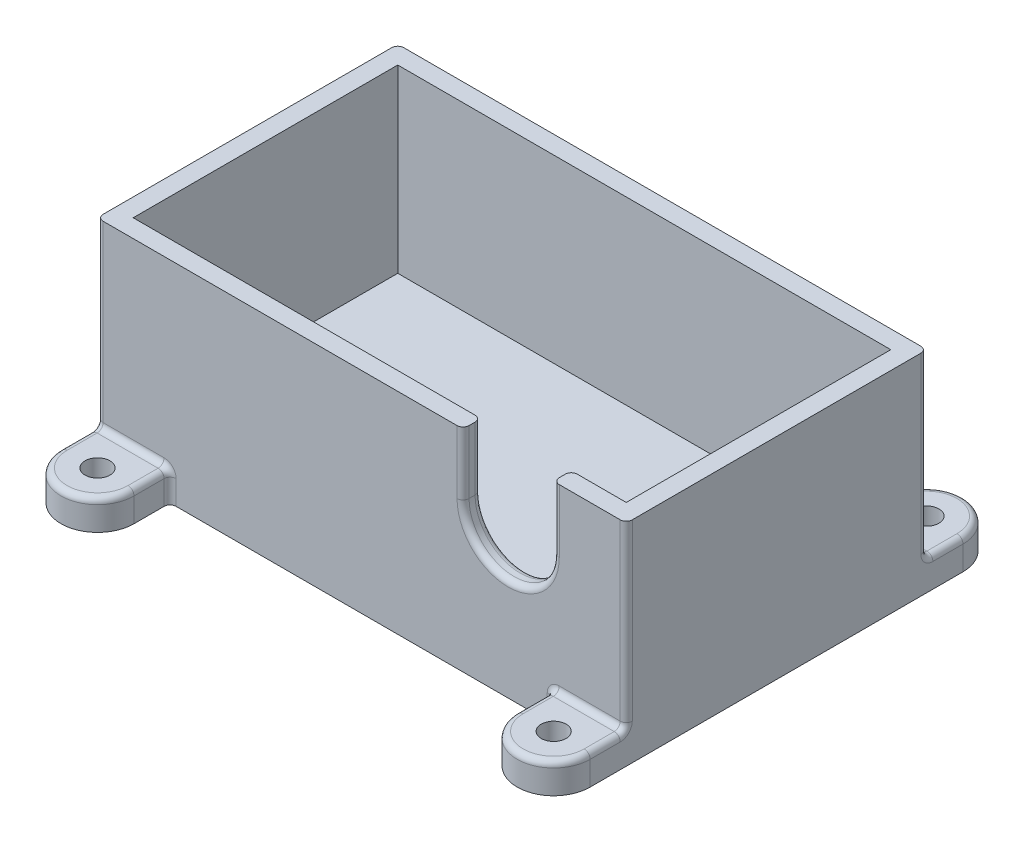
from build123d import *

# Parameters (mm, degrees)
SKETCH2_R           = 2.07
BOSS_EXTRUDE1_DEPTH = 5
SKETCH3_W           = 88
SKETCH3_H           = 50
SKETCH3_W_2         = 82
SKETCH3_H_2         = 44
BOSS_EXTRUDE2_DEPTH = 30
CUT_EXTRUDE1_DEPTH  = 30
FILLET1_R           = 1


with BuildPart() as part:
    # Sketch2 → Boss-Extrude1 (new body)
    # profile 1 of 8: a face of its own
    with BuildSketch(Plane(origin=(0, 0, 0), x_dir=(1, 0, 0), z_dir=(0, 1, 0))):
        with BuildLine():
            Line((-31.86, 0), (-44, 0))
            Line((-44, 0), (-44, -6))
            ThreePointArc((-44, -6), (-37.93, -12.07), (-31.86, -6))
            Line((-31.86, -6), (-31.86, 0))
        make_face()
        with Locations(Location((-37.93, -6, 0), (0, 0, 270))):
            Circle(SKETCH2_R, mode=Mode.SUBTRACT)
    # profile 2 of 8: a face of its own
    with BuildSketch(Plane(origin=(0, 0, 0), x_dir=(1, 0, 0), z_dir=(0, 1, 0))):
        Polygon((0, 25), (-44, 25), (-44, 0), (-31.86, 0), (0, 0), align=None)
    # profile 3 of 8: a face of its own
    with BuildSketch(Plane(origin=(0, 0, 0), x_dir=(1, 0, 0), z_dir=(0, 1, 0))):
        Polygon((-44, 50), (-44, 25), (0, 25), (0, 50), (-31.86, 50), align=None)
    # profile 4 of 8: a face of its own
    with BuildSketch(Plane(origin=(0, 0, 0), x_dir=(1, 0, 0), z_dir=(0, 1, 0))):
        with BuildLine():
            Line((-44, 56), (-44, 50))
            Line((-44, 50), (-31.86, 50))
            Line((-31.86, 50), (-31.86, 56))
            ThreePointArc((-31.86, 56), (-37.93, 62.07), (-44, 56))
        make_face()
        with Locations(Location((-37.93, 56, 0), (0, 0, 270))):
            Circle(SKETCH2_R, mode=Mode.SUBTRACT)
    # profile 5 of 8: a face of its own
    with BuildSketch(Plane(origin=(0, 0, 0), x_dir=(1, 0, 0), z_dir=(0, 1, 0))):
        with BuildLine():
            Line((44, -6), (44, 0))
            Line((44, 0), (31.86, 0))
            Line((31.86, 0), (31.86, -6))
            ThreePointArc((31.86, -6), (37.93, -12.07), (44, -6))
        make_face()
        with Locations(Location((37.93, -6, 0), (0, 0, 270))):
            Circle(SKETCH2_R, mode=Mode.SUBTRACT)
    # profile 6 of 8: a face of its own
    with BuildSketch(Plane(origin=(0, 0, 0), x_dir=(1, 0, 0), z_dir=(0, 1, 0))):
        with BuildLine():
            Line((31.86, 50), (44, 50))
            Line((44, 50), (44, 56))
            ThreePointArc((44, 56), (37.93, 62.07), (31.86, 56))
            Line((31.86, 56), (31.86, 50))
        make_face()
        with Locations(Location((37.93, 56, 0), (0, 0, 270))):
            Circle(SKETCH2_R, mode=Mode.SUBTRACT)
    # profile 7 of 8: a face of its own
    with BuildSketch(Plane(origin=(0, 0, 0), x_dir=(1, 0, 0), z_dir=(0, 1, 0))):
        Polygon((0, 50), (0, 25), (44, 25), (44, 50), (31.86, 50), align=None)
    # profile 8 of 8: a face of its own
    with BuildSketch(Plane(origin=(0, 0, 0), x_dir=(1, 0, 0), z_dir=(0, 1, 0))):
        Polygon((44, 25), (0, 25), (0, 0), (31.86, 0), (44, 0), align=None)
    extrude(amount=BOSS_EXTRUDE1_DEPTH)

    # Sketch3 → Boss-Extrude2 (add)
    with BuildSketch(Plane(origin=(0, 5, 0), x_dir=(1, 0, 0), z_dir=(0, 1, 0))):
        with Locations((0, 25)):
            Rectangle(SKETCH3_W, SKETCH3_H)
        with Locations((0, 25)):
            Rectangle(SKETCH3_W_2, SKETCH3_H_2, mode=Mode.SUBTRACT)
    extrude(amount=BOSS_EXTRUDE2_DEPTH)

    # Sketch4 → Cut-Extrude1 (cut)
    with BuildSketch(Plane.XY):
        with BuildLine():
            Line((16.86, 24.494837281), (16.86, 38.260432579))
            ThreePointArc((16.86, 38.260432579), (24.36, 45.760432579), (31.86, 38.260432579))
            Line((31.86, 38.260432579), (31.86, 24.494837281))
            ThreePointArc((31.86, 24.494837281), (24.36, 16.994837281), (16.86, 24.494837281))
        make_face()
    extrude(amount=-CUT_EXTRUDE1_DEPTH, mode=Mode.SUBTRACT)

    # Fillet1
    fillet1_edges = [part.edges().sort_by_distance(p)[0] for p in [
        (16.86, 29.74741864, 0),
        (24.36, 16.994837281, 0),
        (31.86, 29.74741864, 0),
        (44, 5, -53),
        (37.93, 5, -62.07),
        (31.86, 5, -53),
        (31.86, 2.5, 0),
        (-31.86, 2.5, 0),
        (-31.86, 2.5, -50),
        (31.86, 2.5, -50),
        (-31.86, 5, -53),
        (-37.93, 5, -62.07),
        (-44, 5, -53),
        (44, 5, 3),
        (-37.93, 5, 12.07),
        (-44, 5, 3),
        (37.93, 5, 0),
        (-31.86, 5, 3),
        (-37.93, 5, -50),
        (-44, 20, -50),
        (-37.93, 5, 0),
        (-44, 20, 0),
        (44, 20, 0),
        (37.93, 5, -50),
        (44, 20, -50),
        (31.86, 5, 3),
        (37.93, 5, 12.07),
        (31.86, 29.74741864, -3),
        (24.36, 16.994837281, -3),
        (16.86, 29.74741864, -3),
    ]]
    fillet(fillet1_edges, radius=FILLET1_R)


solid = part.part
